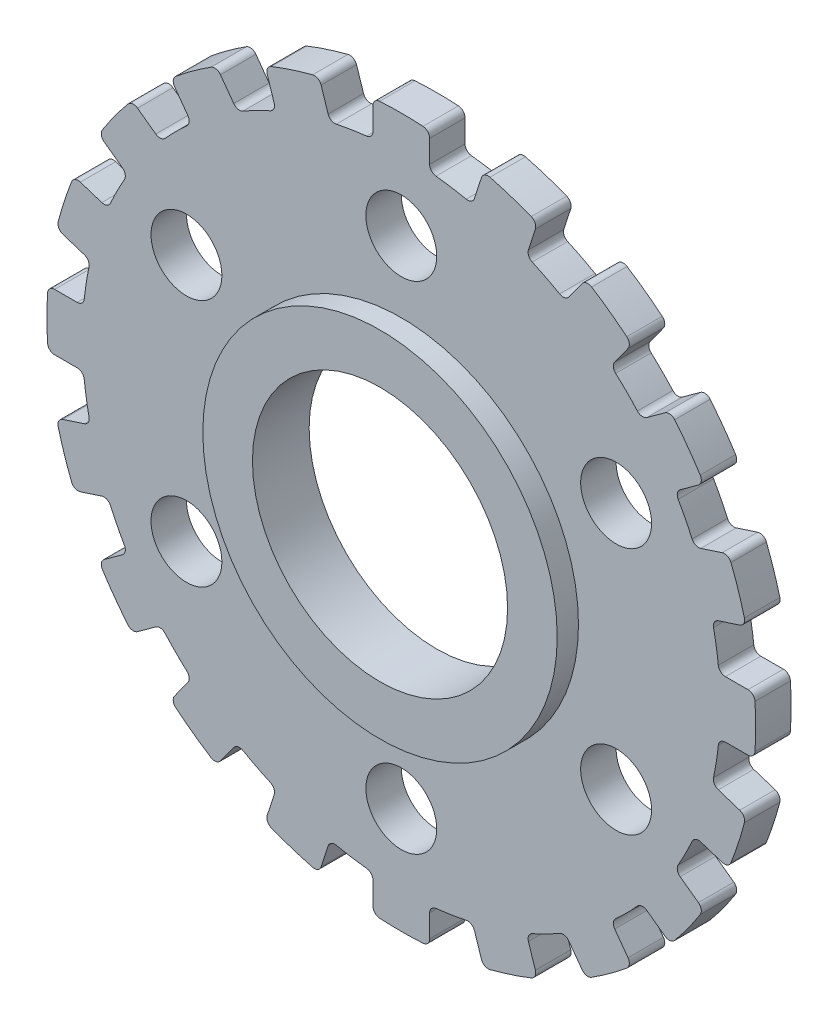
from build123d import *

# Parameters (mm, degrees)
CROQUIS1_R              = 18
CROQUIS1_R_2            = 5
SALIENTE_EXTRUIR1_DEPTH = 5
CROQUIS2_R              = 25
CROQUIS2_R_2            = 18
SALIENTE_EXTRUIR2_DEPTH = 3


with BuildPart() as part:
    # Croquis1 → Saliente-Extruir1 (new body)
    with BuildSketch(Plane.XY):
        with BuildLine():
            Line((11.309200903, 47.750413348), (10.326334164, 44.725460565))
            ThreePointArc((10.326334164, 44.725460565), (9.877091338, 44.169501826), (9.171467264, 44.055467178))
            ThreePointArc((9.171467264, 44.055467178), (7.039550927, 44.445975327), (4.891304348, 44.733378385))
            ThreePointArc((4.891304348, 44.733378385), (4.255454618, 45.059881611), (4, 45.727453461))
            Line((4, 45.727453461), (4, 48.908077043))
            ThreePointArc((4, 48.908077043), (3.728431359, 49.593195832), (3.06122449, 49.906201064))
            ThreePointArc((3.06122449, 49.906201064), (0, 50), (-3.06122449, 49.906201064))
            ThreePointArc((-3.06122449, 49.906201064), (-3.728431359, 49.593195832), (-4, 48.908077043))
            Line((-4, 48.908077043), (-4, 45.727453461))
            ThreePointArc((-4, 45.727453461), (-4.255454618, 45.059881611), (-4.891304348, 44.733378385))
            ThreePointArc((-4.891304348, 44.733378385), (-7.039550927, 44.445975327), (-9.171467264, 44.055467178))
            ThreePointArc((-9.171467264, 44.055467178), (-9.877091338, 44.169501826), (-10.326334164, 44.725460565))
            Line((-10.326334164, 44.725460565), (-11.309200903, 47.750413348))
            ThreePointArc((-11.309200903, 47.750413348), (-11.779191378, 48.318080712), (-12.510466755, 48.409588116))
            ThreePointArc((-12.510466755, 48.409588116), (-15.450849719, 47.552825815), (-18.333261752, 46.517647334))
            ThreePointArc((-18.333261752, 46.517647334), (-18.871089257, 46.013783407), (-18.917653034, 45.278277393))
            Line((-18.917653034, 45.278277393), (-17.934786294, 42.25332461))
            ThreePointArc((-17.934786294, 42.25332461), (-17.971447027, 41.539486234), (-18.47528101, 41.032474841))
            ThreePointArc((-18.47528101, 41.032474841), (-20.429572488, 40.095293588), (-22.336471758, 39.06509989))
            ThreePointArc((-22.336471758, 39.06509989), (-23.042798777, 38.955503454), (-23.641854792, 39.345427968))
            Line((-23.641854792, 39.345427968), (-25.511378426, 41.918606499))
            ThreePointArc((-25.511378426, 41.918606499), (-26.133784792, 42.3132552), (-26.857546347, 42.174307394))
            ThreePointArc((-26.857546347, 42.174307394), (-29.389262615, 40.450849719), (-31.810711619, 38.575622176))
            ThreePointArc((-31.810711619, 38.575622176), (-32.166513456, 37.930221266), (-31.983514381, 37.21632448))
            Line((-31.983514381, 37.21632448), (-30.113990747, 34.64314595))
            ThreePointArc((-30.113990747, 34.64314595), (-29.928268986, 33.952916522), (-30.250768442, 33.31502677))
            ThreePointArc((-30.250768442, 33.31502677), (-31.819805153, 31.819805153), (-33.31502677, 30.250768442))
            ThreePointArc((-33.31502677, 30.250768442), (-33.952916522, 29.928268986), (-34.64314595, 30.113990747))
            Line((-34.64314595, 30.113990747), (-37.21632448, 31.983514381))
            ThreePointArc((-37.21632448, 31.983514381), (-37.930221266, 32.166513456), (-38.575622176, 31.810711619))
            ThreePointArc((-38.575622176, 31.810711619), (-40.450849719, 29.389262615), (-42.174307394, 26.857546347))
            ThreePointArc((-42.174307394, 26.857546347), (-42.3132552, 26.133784792), (-41.918606499, 25.511378426))
            Line((-41.918606499, 25.511378426), (-39.345427968, 23.641854792))
            ThreePointArc((-39.345427968, 23.641854792), (-38.955503454, 23.042798777), (-39.06509989, 22.336471758))
            ThreePointArc((-39.06509989, 22.336471758), (-40.095293588, 20.429572488), (-41.032474841, 18.47528101))
            ThreePointArc((-41.032474841, 18.47528101), (-41.539486234, 17.971447027), (-42.25332461, 17.934786294))
            Line((-42.25332461, 17.934786294), (-45.278277393, 18.917653034))
            ThreePointArc((-45.278277393, 18.917653034), (-46.013783407, 18.871089257), (-46.517647334, 18.333261752))
            ThreePointArc((-46.517647334, 18.333261752), (-47.552825815, 15.450849719), (-48.409588116, 12.510466755))
            ThreePointArc((-48.409588116, 12.510466755), (-48.318080712, 11.779191378), (-47.750413348, 11.309200903))
            Line((-47.750413348, 11.309200903), (-44.725460565, 10.326334164))
            ThreePointArc((-44.725460565, 10.326334164), (-44.169501826, 9.877091338), (-44.055467178, 9.171467264))
            ThreePointArc((-44.055467178, 9.171467264), (-44.445975327, 7.039550927), (-44.733378385, 4.891304348))
            ThreePointArc((-44.733378385, 4.891304348), (-45.059881611, 4.255454618), (-45.727453461, 4))
            Line((-45.727453461, 4), (-48.908077043, 4))
            ThreePointArc((-48.908077043, 4), (-49.593195832, 3.728431359), (-49.906201064, 3.06122449))
            ThreePointArc((-49.906201064, 3.06122449), (-50, 0), (-49.906201064, -3.06122449))
            ThreePointArc((-49.906201064, -3.06122449), (-49.593195832, -3.728431359), (-48.908077043, -4))
            Line((-48.908077043, -4), (-45.727453461, -4))
            ThreePointArc((-45.727453461, -4), (-45.059881611, -4.255454618), (-44.733378385, -4.891304348))
            ThreePointArc((-44.733378385, -4.891304348), (-44.445975327, -7.039550927), (-44.055467178, -9.171467264))
            ThreePointArc((-44.055467178, -9.171467264), (-44.169501826, -9.877091338), (-44.725460565, -10.326334164))
            Line((-44.725460565, -10.326334164), (-47.750413348, -11.309200903))
            ThreePointArc((-47.750413348, -11.309200903), (-48.318080712, -11.779191378), (-48.409588116, -12.510466755))
            ThreePointArc((-48.409588116, -12.510466755), (-47.552825815, -15.450849719), (-46.517647334, -18.333261752))
            ThreePointArc((-46.517647334, -18.333261752), (-46.013783407, -18.871089257), (-45.278277393, -18.917653034))
            Line((-45.278277393, -18.917653034), (-42.25332461, -17.934786294))
            ThreePointArc((-42.25332461, -17.934786294), (-41.539486234, -17.971447027), (-41.032474841, -18.47528101))
            ThreePointArc((-41.032474841, -18.47528101), (-40.095293588, -20.429572488), (-39.06509989, -22.336471758))
            ThreePointArc((-39.06509989, -22.336471758), (-38.955503454, -23.042798777), (-39.345427968, -23.641854792))
            Line((-39.345427968, -23.641854792), (-41.918606499, -25.511378426))
            ThreePointArc((-41.918606499, -25.511378426), (-42.3132552, -26.133784792), (-42.174307394, -26.857546347))
            ThreePointArc((-42.174307394, -26.857546347), (-40.450849719, -29.389262615), (-38.575622176, -31.810711619))
            ThreePointArc((-38.575622176, -31.810711619), (-37.930221266, -32.166513456), (-37.21632448, -31.983514381))
            Line((-37.21632448, -31.983514381), (-34.64314595, -30.113990747))
            ThreePointArc((-34.64314595, -30.113990747), (-33.952916522, -29.928268986), (-33.31502677, -30.250768442))
            ThreePointArc((-33.31502677, -30.250768442), (-31.819805153, -31.819805153), (-30.250768442, -33.31502677))
            ThreePointArc((-30.250768442, -33.31502677), (-29.928268986, -33.952916522), (-30.113990747, -34.64314595))
            Line((-30.113990747, -34.64314595), (-31.983514381, -37.21632448))
            ThreePointArc((-31.983514381, -37.21632448), (-32.166513456, -37.930221266), (-31.810711619, -38.575622176))
            ThreePointArc((-31.810711619, -38.575622176), (-29.389262615, -40.450849719), (-26.857546347, -42.174307394))
            ThreePointArc((-26.857546347, -42.174307394), (-26.133784792, -42.3132552), (-25.511378426, -41.918606499))
            Line((-25.511378426, -41.918606499), (-23.641854792, -39.345427968))
            ThreePointArc((-23.641854792, -39.345427968), (-23.042798777, -38.955503454), (-22.336471758, -39.06509989))
            ThreePointArc((-22.336471758, -39.06509989), (-20.429572488, -40.095293588), (-18.47528101, -41.032474841))
            ThreePointArc((-18.47528101, -41.032474841), (-17.971447027, -41.539486234), (-17.934786294, -42.25332461))
            Line((-17.934786294, -42.25332461), (-18.917653034, -45.278277393))
            ThreePointArc((-18.917653034, -45.278277393), (-18.871089257, -46.013783407), (-18.333261752, -46.517647334))
            ThreePointArc((-18.333261752, -46.517647334), (-15.450849719, -47.552825815), (-12.510466755, -48.409588116))
            ThreePointArc((-12.510466755, -48.409588116), (-11.779191378, -48.318080712), (-11.309200903, -47.750413348))
            Line((-11.309200903, -47.750413348), (-10.326334164, -44.725460565))
            ThreePointArc((-10.326334164, -44.725460565), (-9.877091338, -44.169501826), (-9.171467264, -44.055467178))
            ThreePointArc((-9.171467264, -44.055467178), (-7.039550927, -44.445975327), (-4.891304348, -44.733378385))
            ThreePointArc((-4.891304348, -44.733378385), (-4.255454618, -45.059881611), (-4, -45.727453461))
            Line((-4, -45.727453461), (-4, -48.908077043))
            ThreePointArc((-4, -48.908077043), (-3.728431359, -49.593195832), (-3.06122449, -49.906201064))
            ThreePointArc((-3.06122449, -49.906201064), (0, -50), (3.06122449, -49.906201064))
            ThreePointArc((3.06122449, -49.906201064), (3.728431359, -49.593195832), (4, -48.908077043))
            Line((4, -48.908077043), (4, -45.727453461))
            ThreePointArc((4, -45.727453461), (4.255454618, -45.059881611), (4.891304348, -44.733378385))
            ThreePointArc((4.891304348, -44.733378385), (7.039550927, -44.445975327), (9.171467264, -44.055467178))
            ThreePointArc((9.171467264, -44.055467178), (9.877091338, -44.169501826), (10.326334164, -44.725460565))
            Line((10.326334164, -44.725460565), (11.309200903, -47.750413348))
            ThreePointArc((11.309200903, -47.750413348), (11.779191378, -48.318080712), (12.510466755, -48.409588116))
            ThreePointArc((12.510466755, -48.409588116), (15.450849719, -47.552825815), (18.333261752, -46.517647334))
            ThreePointArc((18.333261752, -46.517647334), (18.871089257, -46.013783407), (18.917653034, -45.278277393))
            Line((18.917653034, -45.278277393), (17.934786294, -42.25332461))
            ThreePointArc((17.934786294, -42.25332461), (17.971447027, -41.539486234), (18.47528101, -41.032474841))
            ThreePointArc((18.47528101, -41.032474841), (20.429572488, -40.095293588), (22.336471758, -39.06509989))
            ThreePointArc((22.336471758, -39.06509989), (23.042798777, -38.955503454), (23.641854792, -39.345427968))
            Line((23.641854792, -39.345427968), (25.511378426, -41.918606499))
            ThreePointArc((25.511378426, -41.918606499), (26.133784792, -42.3132552), (26.857546347, -42.174307394))
            ThreePointArc((26.857546347, -42.174307394), (29.389262615, -40.450849719), (31.810711619, -38.575622176))
            ThreePointArc((31.810711619, -38.575622176), (32.166513456, -37.930221266), (31.983514381, -37.21632448))
            Line((31.983514381, -37.21632448), (30.113990747, -34.64314595))
            ThreePointArc((30.113990747, -34.64314595), (29.928268986, -33.952916522), (30.250768442, -33.31502677))
            ThreePointArc((30.250768442, -33.31502677), (31.819805153, -31.819805153), (33.31502677, -30.250768442))
            ThreePointArc((33.31502677, -30.250768442), (33.952916522, -29.928268986), (34.64314595, -30.113990747))
            Line((34.64314595, -30.113990747), (37.21632448, -31.983514381))
            ThreePointArc((37.21632448, -31.983514381), (37.930221266, -32.166513456), (38.575622176, -31.810711619))
            ThreePointArc((38.575622176, -31.810711619), (40.450849719, -29.389262615), (42.174307394, -26.857546347))
            ThreePointArc((42.174307394, -26.857546347), (42.3132552, -26.133784792), (41.918606499, -25.511378426))
            Line((41.918606499, -25.511378426), (39.345427968, -23.641854792))
            ThreePointArc((39.345427968, -23.641854792), (38.955503454, -23.042798777), (39.06509989, -22.336471758))
            ThreePointArc((39.06509989, -22.336471758), (40.095293588, -20.429572488), (41.032474841, -18.47528101))
            ThreePointArc((41.032474841, -18.47528101), (41.539486234, -17.971447027), (42.25332461, -17.934786294))
            Line((42.25332461, -17.934786294), (45.278277393, -18.917653034))
            ThreePointArc((45.278277393, -18.917653034), (46.013783407, -18.871089257), (46.517647334, -18.333261752))
            ThreePointArc((46.517647334, -18.333261752), (47.552825815, -15.450849719), (48.409588116, -12.510466755))
            ThreePointArc((48.409588116, -12.510466755), (48.318080712, -11.779191378), (47.750413348, -11.309200903))
            Line((47.750413348, -11.309200903), (44.725460565, -10.326334164))
            ThreePointArc((44.725460565, -10.326334164), (44.169501826, -9.877091338), (44.055467178, -9.171467264))
            ThreePointArc((44.055467178, -9.171467264), (44.445975327, -7.039550927), (44.733378385, -4.891304348))
            ThreePointArc((44.733378385, -4.891304348), (45.059881611, -4.255454618), (45.727453461, -4))
            Line((45.727453461, -4), (48.908077043, -4))
            ThreePointArc((48.908077043, -4), (49.593195832, -3.728431359), (49.906201064, -3.06122449))
            ThreePointArc((49.906201064, -3.06122449), (50, 0), (49.906201064, 3.06122449))
            ThreePointArc((49.906201064, 3.06122449), (49.593195832, 3.728431359), (48.908077043, 4))
            Line((48.908077043, 4), (45.727453461, 4))
            ThreePointArc((45.727453461, 4), (45.059881611, 4.255454618), (44.733378385, 4.891304348))
            ThreePointArc((44.733378385, 4.891304348), (44.445975327, 7.039550927), (44.055467178, 9.171467264))
            ThreePointArc((44.055467178, 9.171467264), (44.169501826, 9.877091338), (44.725460565, 10.326334164))
            Line((44.725460565, 10.326334164), (47.750413348, 11.309200903))
            ThreePointArc((47.750413348, 11.309200903), (48.318080712, 11.779191378), (48.409588116, 12.510466755))
            ThreePointArc((48.409588116, 12.510466755), (47.552825815, 15.450849719), (46.517647334, 18.333261752))
            ThreePointArc((46.517647334, 18.333261752), (46.013783407, 18.871089257), (45.278277393, 18.917653034))
            Line((45.278277393, 18.917653034), (42.25332461, 17.934786294))
            ThreePointArc((42.25332461, 17.934786294), (41.539486234, 17.971447027), (41.032474841, 18.47528101))
            ThreePointArc((41.032474841, 18.47528101), (40.095293588, 20.429572488), (39.06509989, 22.336471758))
            ThreePointArc((39.06509989, 22.336471758), (38.955503454, 23.042798777), (39.345427968, 23.641854792))
            Line((39.345427968, 23.641854792), (41.918606499, 25.511378426))
            ThreePointArc((41.918606499, 25.511378426), (42.3132552, 26.133784792), (42.174307394, 26.857546347))
            ThreePointArc((42.174307394, 26.857546347), (40.450849719, 29.389262615), (38.575622176, 31.810711619))
            ThreePointArc((38.575622176, 31.810711619), (37.930221266, 32.166513456), (37.21632448, 31.983514381))
            Line((37.21632448, 31.983514381), (34.64314595, 30.113990747))
            ThreePointArc((34.64314595, 30.113990747), (33.952916522, 29.928268986), (33.31502677, 30.250768442))
            ThreePointArc((33.31502677, 30.250768442), (31.819805153, 31.819805153), (30.250768442, 33.31502677))
            ThreePointArc((30.250768442, 33.31502677), (29.928268986, 33.952916522), (30.113990747, 34.64314595))
            Line((30.113990747, 34.64314595), (31.983514381, 37.21632448))
            ThreePointArc((31.983514381, 37.21632448), (32.166513456, 37.930221266), (31.810711619, 38.575622176))
            ThreePointArc((31.810711619, 38.575622176), (29.389262615, 40.450849719), (26.857546347, 42.174307394))
            ThreePointArc((26.857546347, 42.174307394), (26.133784792, 42.3132552), (25.511378426, 41.918606499))
            Line((25.511378426, 41.918606499), (23.641854792, 39.345427968))
            ThreePointArc((23.641854792, 39.345427968), (23.042798777, 38.955503454), (22.336471758, 39.06509989))
            ThreePointArc((22.336471758, 39.06509989), (20.429572488, 40.095293588), (18.47528101, 41.032474841))
            ThreePointArc((18.47528101, 41.032474841), (17.971447027, 41.539486234), (17.934786294, 42.25332461))
            Line((17.934786294, 42.25332461), (18.917653034, 45.278277393))
            ThreePointArc((18.917653034, 45.278277393), (18.871089257, 46.013783407), (18.333261752, 46.517647334))
            ThreePointArc((18.333261752, 46.517647334), (15.450849719, 47.552825815), (12.510466755, 48.409588116))
            ThreePointArc((12.510466755, 48.409588116), (11.779191378, 48.318080712), (11.309200903, 47.750413348))
        make_face()
        Circle(CROQUIS1_R, mode=Mode.SUBTRACT)
        with Locations((0, 35)):
            Circle(CROQUIS1_R_2, mode=Mode.SUBTRACT)
        with Locations((30.310889132, 17.5)):
            Circle(CROQUIS1_R_2, mode=Mode.SUBTRACT)
        with Locations((30.310889132, -17.5)):
            Circle(CROQUIS1_R_2, mode=Mode.SUBTRACT)
        with Locations((0, -35)):
            Circle(CROQUIS1_R_2, mode=Mode.SUBTRACT)
        with Locations((-30.310889132, -17.5)):
            Circle(CROQUIS1_R_2, mode=Mode.SUBTRACT)
        with Locations((-30.310889132, 17.5)):
            Circle(CROQUIS1_R_2, mode=Mode.SUBTRACT)
    extrude(amount=SALIENTE_EXTRUIR1_DEPTH)

    # Croquis2 → Saliente-Extruir2 (add)
    with BuildSketch(Plane.XY.offset(5)):
        Circle(CROQUIS2_R)
        Circle(CROQUIS2_R_2, mode=Mode.SUBTRACT)
    extrude(amount=SALIENTE_EXTRUIR2_DEPTH)


solid = part.part
